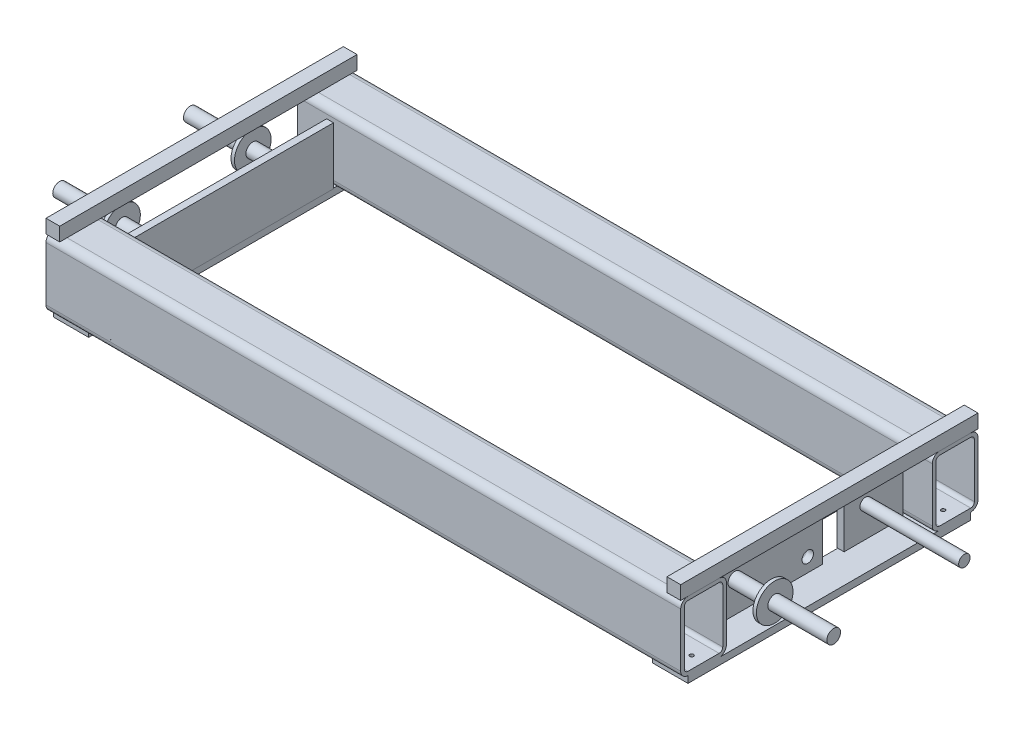
from build123d import *

# Parameters (mm, degrees)
C_PROGRAM_FILES_SOLIDWORKS_CORP_SOLIDWOR_DEPTH = 555
C_PROGRAM_FILES_SOLIDWORKS_CORP_SOLI_2_DEPTH   = 555
SKETCH3_W                                      = 12
SKETCH3_H                                      = 260
BOSS_EXTRUDE1_DEPTH                            = 12
BOSS_EXTRUDE1_2_DEPTH                          = 12
SKETCH4_W                                      = 6
SKETCH4_H                                      = 50
BOSS_EXTRUDE2_DEPTH                            = 90
BOSS_EXTRUDE2_2_DEPTH                          = 90
SKETCH5_R                                      = 6
BOSS_EXTRUDE3_DEPTH                            = 86.36
BOSS_EXTRUDE3_2_DEPTH                          = 86.36
BOSS_EXTRUDE4_START                            = -54.61
SKETCH7_R                                      = 16
SKETCH7_R_2                                    = 6
BOSS_EXTRUDE4_DEPTH                            = 3
BOSS_EXTRUDE4_2_DEPTH                          = 3
SKETCH8_R                                      = 6
BOSS_EXTRUDE5_DEPTH                            = 86.36
SKETCH8_R_2                                    = 5
BOSS_EXTRUDE5_2_DEPTH                          = 86.36
BOSS_EXTRUDE6_START                            = -54.61
SKETCH9_R                                      = 16
SKETCH9_R_2                                    = 6
BOSS_EXTRUDE6_DEPTH                            = 3
SKETCH10_W                                     = 30.93815304
SKETCH10_H                                     = 247.2
BOSS_EXTRUDE7_DEPTH                            = 6
CUT_EXTRUDE1_START                             = -9.2
SKETCH11_R                                     = 1.65
CUT_EXTRUDE1_DEPTH                             = 9.2
SKETCH18_R                                     = 8
SKETCH18_R_2                                   = 5
EXTRUDE_THIN1_DEPTH                            = 25.4
BOSS_EXTRUDE8_START                            = -25.4
SKETCH19_R                                     = 5
BOSS_EXTRUDE8_DEPTH                            = 131.73
SKETCH20_W                                     = 12.7
SKETCH20_H                                     = 41.4
BOSS_EXTRUDE9_DEPTH                            = 3
CUT_EXTRUDE2_START                             = -9
SKETCH21_R                                     = 5
CUT_EXTRUDE2_DEPTH                             = 9
SKETCH22_W                                     = 19.05
SKETCH22_H                                     = 50
CUT_EXTRUDE3_DEPTH                             = 6


with BuildPart() as part:
    # Sketch1 → C_PROGRAM FILES_SOLIDWORKS CORP_SOLIDWOR (new body)
    with BuildSketch(Plane(origin=(-277.5, 0, 110), x_dir=(0, 0, -1), z_dir=(1, 0, 0))):
        with BuildLine():
            Line((-13.6, -30), (13.6, -30))
            ThreePointArc((13.6, -30), (18.1254834, -28.1254834), (20, -23.6))
            Line((20, -23.6), (20, 23.6))
            ThreePointArc((20, 23.6), (18.1254834, 28.1254834), (13.6, 30))
            Line((13.6, 30), (-13.6, 30))
            ThreePointArc((-13.6, 30), (-18.1254834, 28.1254834), (-20, 23.6))
            Line((-20, 23.6), (-20, -23.6))
            ThreePointArc((-20, -23.6), (-18.1254834, -28.1254834), (-13.6, -30))
        make_face()
        with BuildLine():
            Line((-13.6, -26.8), (13.6, -26.8))
            ThreePointArc((13.6, -26.8), (15.8627417, -25.8627417), (16.8, -23.6))
            Line((16.8, -23.6), (16.8, 23.6))
            ThreePointArc((16.8, 23.6), (15.8627417, 25.8627417), (13.6, 26.8))
            Line((13.6, 26.8), (-13.6, 26.8))
            ThreePointArc((-13.6, 26.8), (-15.8627417, 25.8627417), (-16.8, 23.6))
            Line((-16.8, 23.6), (-16.8, -23.6))
            ThreePointArc((-16.8, -23.6), (-15.8627417, -25.8627417), (-13.6, -26.8))
        make_face(mode=Mode.SUBTRACT)
    extrude(amount=C_PROGRAM_FILES_SOLIDWORKS_CORP_SOLIDWOR_DEPTH)


with BuildPart() as body_2:
    # Sketch1 on segment 2 (carried to segment 2) → C_PROGRAM FILES_SOLIDWORKS CORP_SOLI 2 (new body)
    with BuildSketch(Plane(origin=(-277.5, 0, -110), x_dir=(0, 0, -1), z_dir=(1, 0, 0))):
        with BuildLine():
            Line((-13.6, -30), (13.6, -30))
            ThreePointArc((13.6, -30), (18.1254834, -28.1254834), (20, -23.6))
            Line((20, -23.6), (20, 23.6))
            ThreePointArc((20, 23.6), (18.1254834, 28.1254834), (13.6, 30))
            Line((13.6, 30), (-13.6, 30))
            ThreePointArc((-13.6, 30), (-18.1254834, 28.1254834), (-20, 23.6))
            Line((-20, 23.6), (-20, -23.6))
            ThreePointArc((-20, -23.6), (-18.1254834, -28.1254834), (-13.6, -30))
        make_face()
        with BuildLine():
            Line((-13.6, -26.8), (13.6, -26.8))
            ThreePointArc((13.6, -26.8), (15.8627417, -25.8627417), (16.8, -23.6))
            Line((16.8, -23.6), (16.8, 23.6))
            ThreePointArc((16.8, 23.6), (15.8627417, 25.8627417), (13.6, 26.8))
            Line((13.6, 26.8), (-13.6, 26.8))
            ThreePointArc((-13.6, 26.8), (-15.8627417, 25.8627417), (-16.8, 23.6))
            Line((-16.8, 23.6), (-16.8, -23.6))
            ThreePointArc((-16.8, -23.6), (-15.8627417, -25.8627417), (-13.6, -26.8))
        make_face(mode=Mode.SUBTRACT)
    extrude(amount=C_PROGRAM_FILES_SOLIDWORKS_CORP_SOLI_2_DEPTH)


with BuildPart() as body_3:
    # Sketch3 → Boss-Extrude1 (new body)
    with BuildSketch(Plane(origin=(0, 30, 0), x_dir=(1, 0, 0), z_dir=(0, 1, 0))):
        with Locations((-271.5, 0)):
            Rectangle(SKETCH3_W, SKETCH3_H)
    extrude(amount=BOSS_EXTRUDE1_DEPTH)


with BuildPart() as body_4:
    # Sketch3 → Boss-Extrude1 2 (new body)
    with BuildSketch(Plane(origin=(0, 30, 0), x_dir=(1, 0, 0), z_dir=(0, 1, 0))):
        with Locations((271.5, 0)):
            Rectangle(SKETCH3_W, SKETCH3_H)
    extrude(amount=BOSS_EXTRUDE1_2_DEPTH)


with BuildPart() as body_5:
    # Sketch4 → Boss-Extrude2 (new, symmetric)
    with BuildSketch(Plane.XY):
        with Locations((-249.1, -5)):
            Rectangle(SKETCH4_W, SKETCH4_H)
    extrude(amount=BOSS_EXTRUDE2_DEPTH, both=True)


with BuildPart() as body_6:
    # Sketch4 → Boss-Extrude2 2 (new, symmetric)
    with BuildSketch(Plane.XY):
        with Locations((249.1, -5)):
            Rectangle(SKETCH4_W, SKETCH4_H)
    extrude(amount=BOSS_EXTRUDE2_2_DEPTH, both=True)


with BuildPart() as body_7:
    # Sketch5 → Boss-Extrude3 (new body)
    with BuildSketch(Plane.ZY.offset(252.1)):
        with Locations((-57.15, -3)):
            Circle(SKETCH5_R)
    extrude(amount=BOSS_EXTRUDE3_DEPTH)


with BuildPart() as body_8:
    # Sketch5 → Boss-Extrude3 2 (new body)
    with BuildSketch(Plane.ZY.offset(252.1)):
        with Locations((57.15, -3)):
            Circle(SKETCH5_R)
    extrude(amount=BOSS_EXTRUDE3_2_DEPTH)


with BuildPart() as body_9:
    # Sketch7 → Boss-Extrude4 (new body)
    with BuildSketch(Plane.ZY.offset(338.46).offset(BOSS_EXTRUDE4_START)):
        with Locations((-57.15, -3)):
            Circle(SKETCH7_R)
        with Locations((-57.15, -3)):
            Circle(SKETCH7_R_2, mode=Mode.SUBTRACT)
    extrude(amount=BOSS_EXTRUDE4_DEPTH)


with BuildPart() as body_10:
    # Sketch7 → Boss-Extrude4 2 (new body)
    with BuildSketch(Plane.ZY.offset(338.46).offset(BOSS_EXTRUDE4_START)):
        with Locations((57.15, -3)):
            Circle(SKETCH7_R)
        with Locations((57.15, -3)):
            Circle(SKETCH7_R_2, mode=Mode.SUBTRACT)
    extrude(amount=BOSS_EXTRUDE4_2_DEPTH)


with BuildPart() as body_11:
    # Sketch8 → Boss-Extrude5 (new body)
    with BuildSketch(Plane(origin=(252.1, 0, 0), x_dir=(0, 0, -1), z_dir=(1, 0, 0))):
        with Locations((-57.15, -3)):
            Circle(SKETCH8_R)
    extrude(amount=BOSS_EXTRUDE5_DEPTH)


with BuildPart() as body_12:
    # Sketch8 → Boss-Extrude5 2 (new body)
    with BuildSketch(Plane(origin=(252.1, 0, 0), x_dir=(0, 0, -1), z_dir=(1, 0, 0))):
        with Locations((57.15, -3)):
            Circle(SKETCH8_R_2)
    extrude(amount=BOSS_EXTRUDE5_2_DEPTH)


with BuildPart() as body_13:
    # Sketch9 → Boss-Extrude6 (new body)
    with BuildSketch(Plane(origin=(338.46, 0, 0), x_dir=(0, 0, -1), z_dir=(1, 0, 0)).offset(BOSS_EXTRUDE6_START)):
        with Locations((-57.15, -3)):
            Circle(SKETCH9_R)
        with Locations((-57.15, -3)):
            Circle(SKETCH9_R_2, mode=Mode.SUBTRACT)
    extrude(amount=BOSS_EXTRUDE6_DEPTH)


with BuildPart() as body_14:
    # Sketch10 → Boss-Extrude7 (new body)
    with BuildSketch(Plane.XZ.offset(30)):
        with Locations((-262.03092348, 0)):
            Rectangle(SKETCH10_W, SKETCH10_H)
    boss_extrude7 = extrude(amount=BOSS_EXTRUDE7_DEPTH)


with BuildPart() as cut_extrude1_tool:
    # Sketch11 → Cut-Extrude1 (new body)
    with BuildSketch(Plane.XZ.offset(36).offset(CUT_EXTRUDE1_START)):
        with Locations(Location((-256.891180293, -110, 0), (0, 0, 270))):
            Circle(SKETCH11_R)
        with Locations(Location((-267.086, -110, 0), (0, 0, 270))):
            Circle(SKETCH11_R)
        with Locations(Location((-267.086, 110, 0), (0, 0, 90))):
            Circle(SKETCH11_R)
        with Locations(Location((-256.891180293, 110, 0), (0, 0, 90))):
            Circle(SKETCH11_R)
    cut_extrude1 = extrude(amount=CUT_EXTRUDE1_DEPTH)


with BuildPart() as part_1:
    add(part.part)

    # Cut-Extrude1: cut by cut_extrude1_tool
    add(cut_extrude1_tool.part, mode=Mode.SUBTRACT)



with BuildPart() as body_2_1:
    add(body_2.part)

    # Cut-Extrude1: cut by cut_extrude1_tool
    add(cut_extrude1_tool.part, mode=Mode.SUBTRACT)


with BuildPart() as body_14_1:
    add(body_14.part)

    # Cut-Extrude1: cut by cut_extrude1_tool
    add(cut_extrude1_tool.part, mode=Mode.SUBTRACT)


with BuildPart() as part_2:
    add(part_1.part)

    add(body_2_1.part)  # Mirror1 merges body 2

    add(body_6.part)  # Mirror1 merges body 6
    # Mirror1: Boss-Extrude7 across plane
    add(boss_extrude7.mirror(Plane(origin=(0, 0, 0), x_dir=(0, 0, 1), z_dir=(1, 0, 0))))

    # Mirror1 2: Cut-Extrude1 across plane
    add(cut_extrude1.mirror(Plane(origin=(0, 0, 0), x_dir=(0, 0, 1), z_dir=(1, 0, 0))), mode=Mode.SUBTRACT)


with BuildPart() as body_13_2:
    # Sketch18 → Extrude-Thin1 (new body)
    with BuildSketch(Plane.XY.offset(-19.230000062)):
        with Locations((238.003999998, -3)):
            Circle(SKETCH18_R)
        with Locations((238.003999998, -3)):
            Circle(SKETCH18_R_2, mode=Mode.SUBTRACT)
    extrude(amount=EXTRUDE_THIN1_DEPTH)


with BuildPart() as body_14_2:
    # Sketch19 → Boss-Extrude8 (new body)
    with BuildSketch(Plane(origin=(0, 0, -19.230000062), x_dir=(-1, 0, 0), z_dir=(0, 0, -1)).offset(BOSS_EXTRUDE8_START)):
        with Locations(Location((-238.003999998, -3, 0), (0, 0, 180))):
            Circle(SKETCH19_R)
    extrude(amount=BOSS_EXTRUDE8_DEPTH)


with BuildPart() as body_15:
    # Sketch20 → Boss-Extrude9 (new body)
    with BuildSketch(Plane.ZY.offset(-246.1)):
        with Locations((-6.530000062, -3)):
            Rectangle(SKETCH20_W, SKETCH20_H)
    extrude(amount=BOSS_EXTRUDE9_DEPTH)


with BuildPart() as cut_extrude2_tool:
    # Sketch21 → Cut-Extrude2 (new body)
    with BuildSketch(Plane.ZY.offset(-243.1).offset(CUT_EXTRUDE2_START)):
        with Locations((-6.530000062, 10.815086206)):
            Circle(SKETCH21_R)
        with Locations((-6.530000062, -17.86213385)):
            Circle(SKETCH21_R)
    extrude(amount=CUT_EXTRUDE2_DEPTH)


with BuildPart() as part_3:
    add(part_2.part)

    # Cut-Extrude2: cut by cut_extrude2_tool
    add(cut_extrude2_tool.part, mode=Mode.SUBTRACT)

    # Sketch22 → Cut-Extrude3 (cut)
    with BuildSketch(Plane.ZY.offset(-246.1)):
        with Locations((-28.755000062, -5)):
            Rectangle(SKETCH22_W, SKETCH22_H)
    extrude(amount=-CUT_EXTRUDE3_DEPTH, mode=Mode.SUBTRACT)


with BuildPart() as body_15_1:
    add(body_15.part)

    # Cut-Extrude2: cut by cut_extrude2_tool
    add(cut_extrude2_tool.part, mode=Mode.SUBTRACT)


solid = Compound([body_3.part, body_4.part, body_5.part, body_7.part, body_8.part, body_9.part, body_10.part, body_11.part, body_12.part, body_13.part, body_14_1.part, body_13_2.part, body_14_2.part, part_3.part, body_15_1.part])
